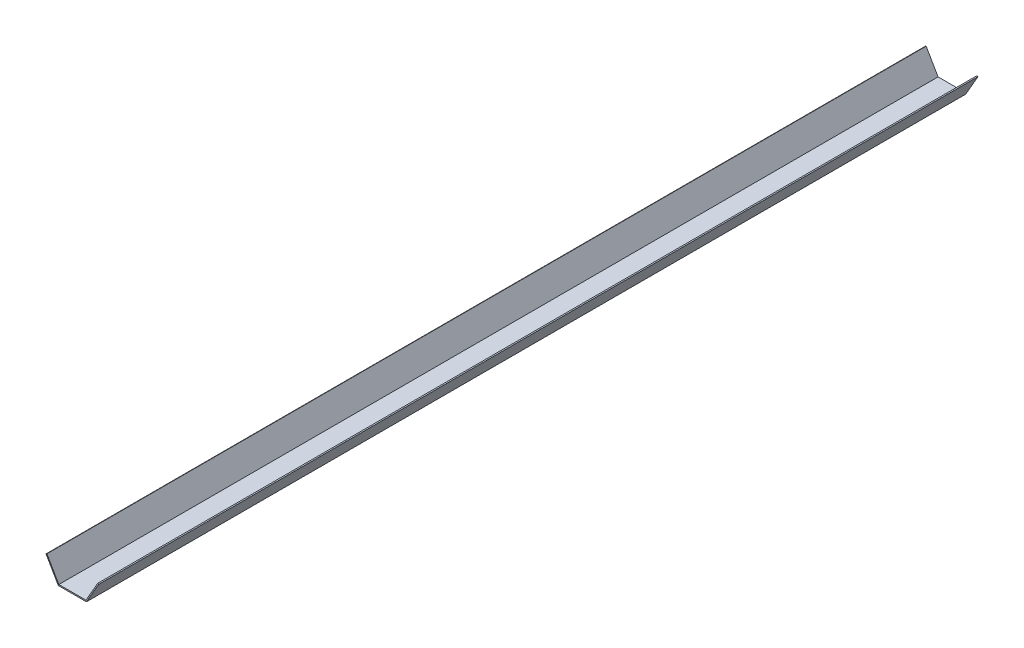
from build123d import *

# Parameters (mm, degrees)
EXTRUDE_1_DEPTH = 1250


with BuildPart() as part:
    # Эскиз1 → Бобышка-Вытянуть1 (new body)
    with BuildSketch(Plane.XY):
        Polygon((-20, -1.700961894), (20, -1.700961894), (37.5, 28.609927238), (36.200961894, 29.359927238), (19.25, 0), (-19.25, 0), (-36.200961894, 29.359927238), (-37.5, 28.609927238), align=None)
    extrude(amount=EXTRUDE_1_DEPTH)


solid = part.part
